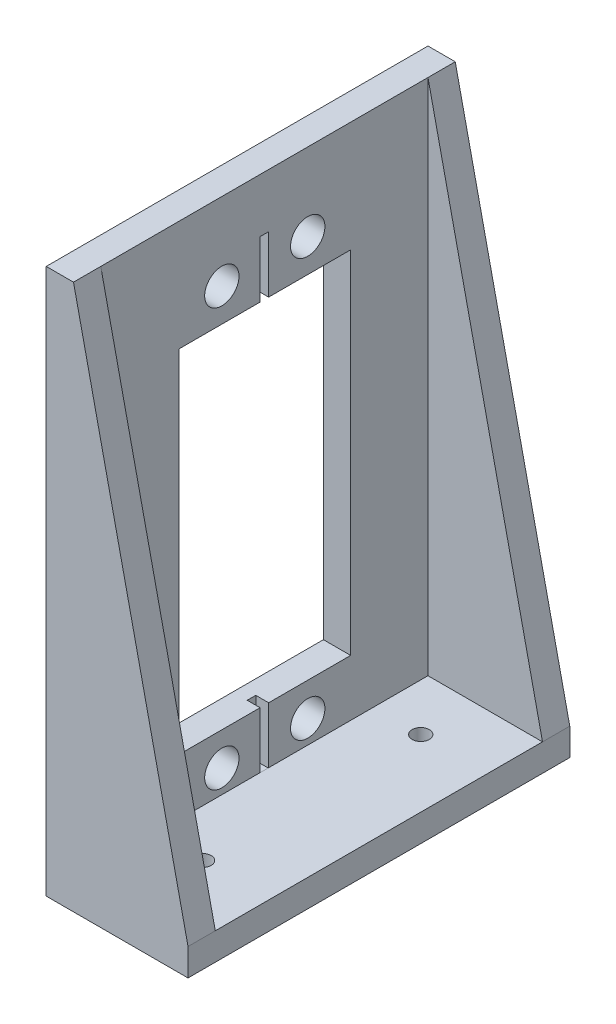
from build123d import *

# Parameters (mm, degrees)
BOSS_EXTRUDE1_DEPTH = 22.225
BOSS_EXTRUDE2_DEPTH = 3.175
SKETCH4_R           = 1.000000032
CUT_EXTRUDE2_DEPTH  = 67.374967797
SKETCH5_R           = 2.000000064
CUT_EXTRUDE3_DEPTH  = 69.585879378
SKETCH6_W           = 19.999999878
SKETCH6_H           = 40.899999988
CUT_EXTRUDE4_DEPTH  = 69.585879378
SKETCH7_W           = 1.500000048
SKETCH7_H           = 1.000000032
CUT_EXTRUDE5_DEPTH  = 6.604
CUT_EXTRUDE6_START  = 40.9
SKETCH7_2_W         = 1.500000048
SKETCH7_2_H         = 1.000000032
CUT_EXTRUDE6_DEPTH  = 6.604


with BuildPart() as part:
    # Sketch1 → Boss-Extrude1 (new, symmetric)
    with BuildSketch(Plane.XY):
        Polygon((0, 0), (0, 63.5), (3.175, 63.5), (3.175, 3.175), (16.51, 3.175), (16.51, 0), align=None)
    extrude(amount=BOSS_EXTRUDE1_DEPTH, both=True)

    # Sketch3 → Boss-Extrude2 (add)
    with BuildSketch(Plane.XY.offset(22.225)):
        Polygon((3.175, 63.5), (16.51, 3.175), (3.175, 3.175), align=None)
    boss_extrude2 = extrude(amount=-BOSS_EXTRUDE2_DEPTH)

    # Mirror1: Boss-Extrude2 across plane
    add(boss_extrude2.mirror(Plane.XY))

    # Sketch4 → Cut-Extrude2 (cut, through all)
    with BuildSketch(Plane(origin=(0, 3.175, 0), x_dir=(1, 0, 0), z_dir=(0, 1, 0))):
        with Locations(Location((8.679999912, 12.7, 0), (0, 0, 180))):
            Circle(SKETCH4_R)
        with Locations((8.679999912, -12.7)):
            Circle(SKETCH4_R)
    extrude(amount=-CUT_EXTRUDE2_DEPTH, mode=Mode.SUBTRACT)

    # Sketch5 → Cut-Extrude3 (cut, through all)
    with BuildSketch(Plane(origin=(3.175, 0, 0), x_dir=(0, 0, -1), z_dir=(1, 0, 0))):
        with Locations(Location((-4.953, 5.874999934, 0), (0, 0, 90))):
            Circle(SKETCH5_R)
        with Locations(Location((5.047000066, 5.874999934, 0), (0, 0, 90))):
            Circle(SKETCH5_R)
        with Locations(Location((-4.953, 54.475000016, 0), (0, 0, 90))):
            Circle(SKETCH5_R)
        with Locations(Location((5.047000066, 54.475000016, 0), (0, 0, 90))):
            Circle(SKETCH5_R)
    extrude(amount=-CUT_EXTRUDE3_DEPTH, mode=Mode.SUBTRACT)

    # Sketch6 → Cut-Extrude4 (cut, through all)
    with BuildSketch(Plane(origin=(3.175, 0, 0), x_dir=(0, 0, -1), z_dir=(1, 0, 0))):
        with Locations((0.047000033, 30.174999975)):
            Rectangle(SKETCH6_W, SKETCH6_H)
    extrude(amount=-CUT_EXTRUDE4_DEPTH, mode=Mode.SUBTRACT)

    # Sketch7 → Cut-Extrude5 (cut)
    with BuildSketch(Plane.XZ.offset(-50.624999969)):
        with Locations((2.424999976, 0)):
            Rectangle(SKETCH7_W, SKETCH7_H)
    extrude(amount=-CUT_EXTRUDE5_DEPTH, mode=Mode.SUBTRACT)

    # Sketch7<2> → Cut-Extrude6 (cut)
    with BuildSketch(Plane.XZ.offset(-50.624999969).offset(CUT_EXTRUDE6_START)):
        with Locations((2.424999976, 0)):
            Rectangle(SKETCH7_2_W, SKETCH7_2_H)
    extrude(amount=CUT_EXTRUDE6_DEPTH, mode=Mode.SUBTRACT)


solid = part.part
